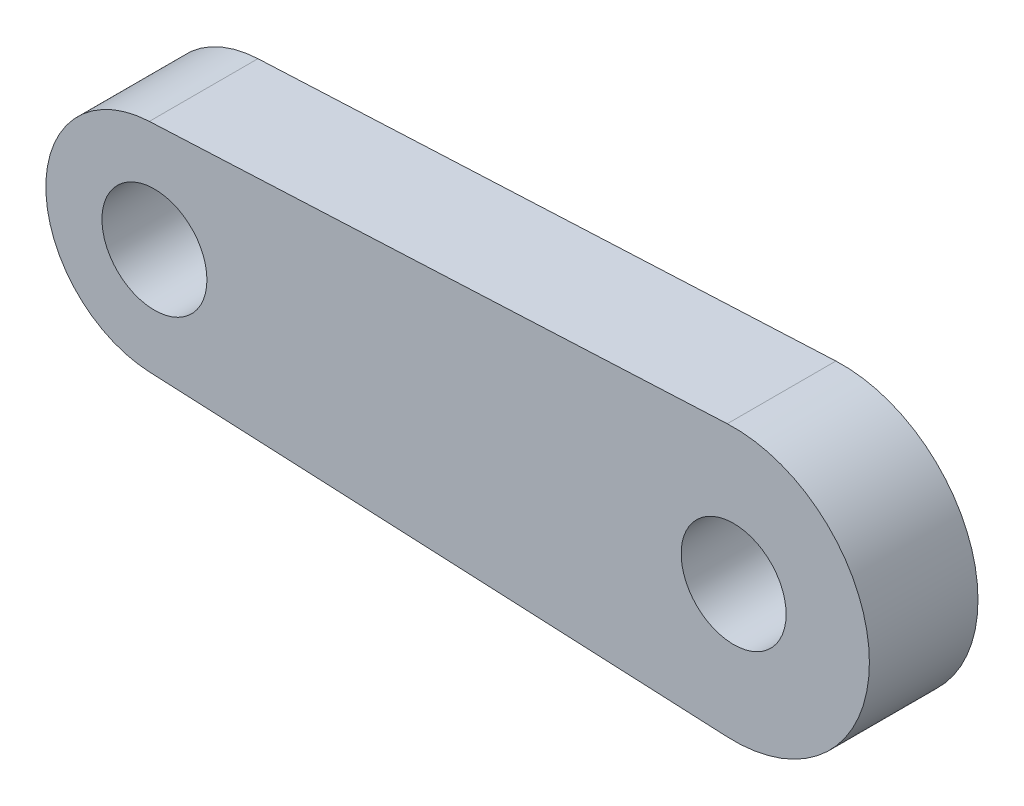
from build123d import *

# Parameters (mm, degrees)
ESQUISSE2_R        = 1.45
BOSS_EXTRU_1_DEPTH = 3


with BuildPart() as part:
    # Esquisse2 → Boss.-Extru.1 (new body)
    with BuildSketch(Plane.XY):
        with BuildLine():
            Line((-8.515791667, -2.996702289), (7.449052083, -3.745877861))
            ThreePointArc((7.449052083, -3.745877861), (11.374833333, 0), (7.449052083, 3.745877861))
            Line((7.449052083, 3.745877861), (-8.515791667, 2.996702289))
            ThreePointArc((-8.515791667, 2.996702289), (-11.375166667, 0), (-8.515791667, -2.996702289))
        make_face()
        with Locations((7.624833333, 0)):
            Circle(ESQUISSE2_R, mode=Mode.SUBTRACT)
        with Locations((-8.375166667, 0)):
            Circle(ESQUISSE2_R, mode=Mode.SUBTRACT)
    extrude(amount=BOSS_EXTRU_1_DEPTH)


solid = part.part
